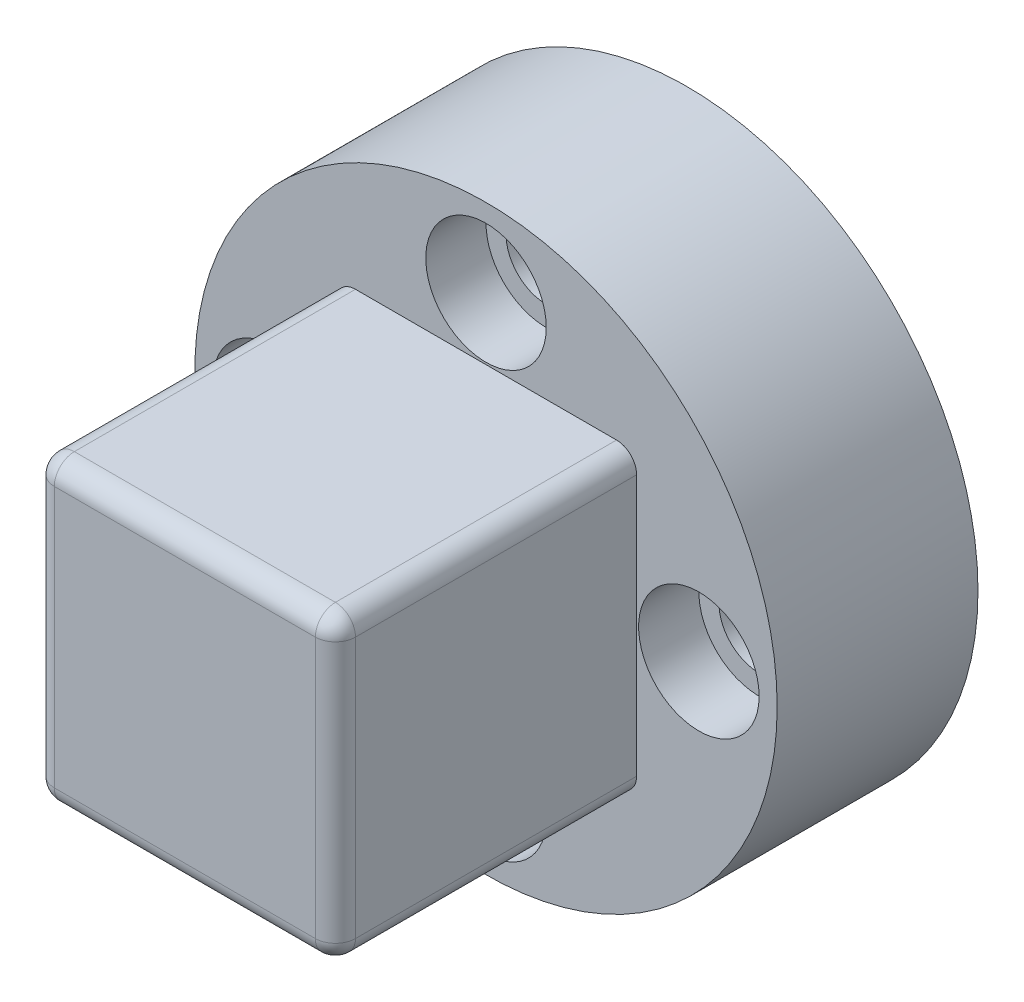
from build123d import *

# Parameters (mm, degrees)
SKETCH1_R           = 14.5
SKETCH1_R_2         = 2
BOSS_EXTRUDE3_DEPTH = 7
SKETCH3_R           = 14.5
SKETCH3_R_2         = 3
BOSS_EXTRUDE4_DEPTH = 3
SKETCH4_W           = 15
SKETCH4_H           = 15
BOSS_EXTRUDE5_DEPTH = 15
FILLET1_R           = 1


with BuildPart() as part:
    # Sketch1 → Boss-Extrude3 (new body)
    with BuildSketch(Plane.XY):
        Circle(SKETCH1_R)
        with Locations((10.6, 0)):
            Circle(SKETCH1_R_2, mode=Mode.SUBTRACT)
        with Locations((0, 10.6)):
            Circle(SKETCH1_R_2, mode=Mode.SUBTRACT)
        with Locations((-10.6, 0)):
            Circle(SKETCH1_R_2, mode=Mode.SUBTRACT)
        with Locations((0, -10.6)):
            Circle(SKETCH1_R_2, mode=Mode.SUBTRACT)
    extrude(amount=BOSS_EXTRUDE3_DEPTH)

    # Sketch3 → Boss-Extrude4 (add)
    with BuildSketch(Plane.XY.offset(7)):
        Circle(SKETCH3_R)
        with Locations((10.6, 0)):
            Circle(SKETCH3_R_2, mode=Mode.SUBTRACT)
        with Locations((0, -10.6)):
            Circle(SKETCH3_R_2, mode=Mode.SUBTRACT)
        with Locations((-10.6, 0)):
            Circle(SKETCH3_R_2, mode=Mode.SUBTRACT)
        with Locations((0, 10.6)):
            Circle(SKETCH3_R_2, mode=Mode.SUBTRACT)
    extrude(amount=BOSS_EXTRUDE4_DEPTH)

    # Sketch4 → Boss-Extrude5 (add)
    with BuildSketch(Plane.XY.offset(10)):
        Rectangle(SKETCH4_W, SKETCH4_H)
    extrude(amount=BOSS_EXTRUDE5_DEPTH)

    # Fillet1
    fillet1_edges = [part.edges().sort_by_distance(p)[0] for p in [
        (7.5, -7.5, 17.5),
        (7.5, 7.5, 17.5),
        (-7.5, 7.5, 17.5),
        (-7.5, -7.5, 17.5),
        (7.5, 0, 25),
        (0, 7.5, 25),
        (-7.5, 0, 25),
        (0, -7.5, 25),
    ]]
    fillet(fillet1_edges, radius=FILLET1_R)


solid = part.part
